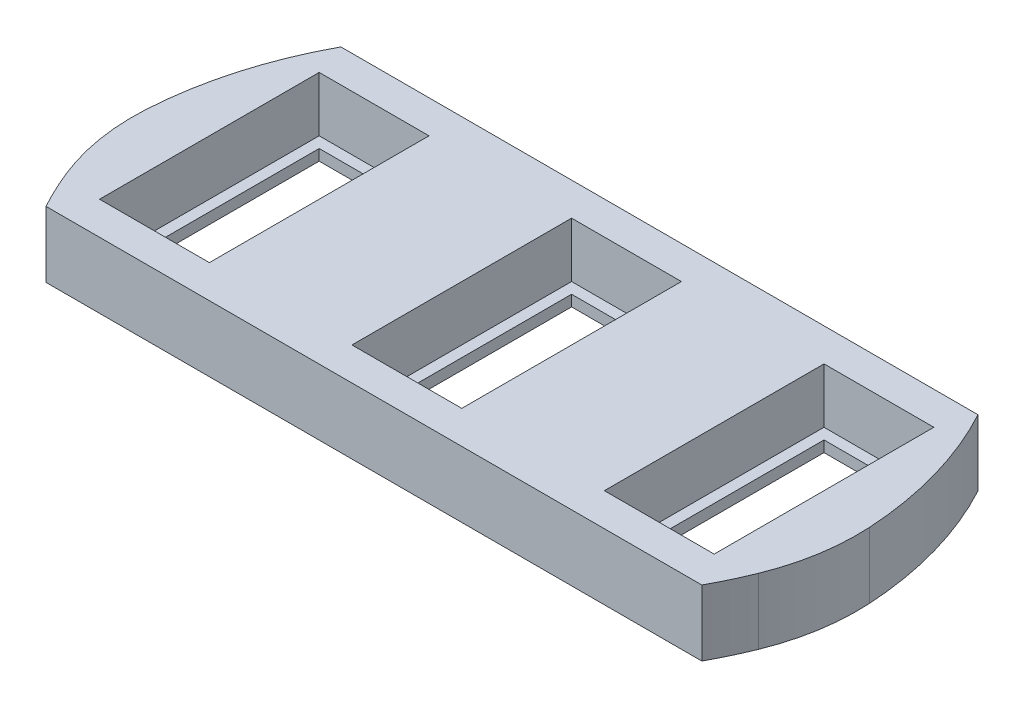
from build123d import *

# Parameters (mm, degrees)
ESQUISSE1_W        = 8
ESQUISSE1_H        = 18
BOSS_EXTRU_1_DEPTH = 1
ESQUISSE2_W        = 10
ESQUISSE2_H        = 20
BOSS_EXTRU_2_DEPTH = 5


with BuildPart() as part:
    # Esquisse1 → Boss.-Extru.1 (new body)
    with BuildSketch(Plane(origin=(0, 0, 0), x_dir=(1, 0, 0), z_dir=(0, 1, 0))):
        with BuildLine():
            Line((29.004988077, 12.738826724), (-29.004988077, 12.738826724))
            ThreePointArc((-29.004988077, 12.738826724), (-31.738037586, 6.038637628), (-32.945035587, -1.096153846))
            ThreePointArc((-32.945035587, -1.096153846), (-32.712152787, -5.502218178), (-31.51884357, -9.75))
            ThreePointArc((-31.51884357, -9.75), (-30.739215763, -11.52930192), (-29.859240507, -13.261173276))
            Line((-29.859240507, -13.261173276), (29.859240507, -13.261173276))
            ThreePointArc((29.859240507, -13.261173276), (30.739215763, -11.52930192), (31.51884357, -9.75))
            ThreePointArc((31.51884357, -9.75), (32.712152787, -5.502218178), (32.945035587, -1.096153846))
            ThreePointArc((32.945035587, -1.096153846), (31.738037586, 6.038637628), (29.004988077, 12.738826724))
        make_face()
        with Locations((22.983419658, -0.261173276)):
            Rectangle(ESQUISSE1_W, ESQUISSE1_H, mode=Mode.SUBTRACT)
        with Locations((-22.983419658, -0.261173276)):
            Rectangle(ESQUISSE1_W, ESQUISSE1_H, mode=Mode.SUBTRACT)
        with Locations((0, -0.261173276)):
            Rectangle(ESQUISSE1_W, ESQUISSE1_H, mode=Mode.SUBTRACT)
    extrude(amount=BOSS_EXTRU_1_DEPTH)

    # Esquisse2 → Boss.-Extru.2 (add)
    with BuildSketch(Plane(origin=(0, 1, 0), x_dir=(1, 0, 0), z_dir=(0, 1, 0))):
        with BuildLine():
            Line((-29.004988077, 12.738826724), (29.004988077, 12.738826724))
            ThreePointArc((29.004988077, 12.738826724), (31.738037586, 6.038637628), (32.945035587, -1.096153846))
            ThreePointArc((32.945035587, -1.096153846), (32.712152787, -5.502218178), (31.51884357, -9.75))
            ThreePointArc((31.51884357, -9.75), (30.739215763, -11.52930192), (29.859240507, -13.261173276))
            Line((29.859240507, -13.261173276), (0, -13.261173276))
            Line((0, -13.261173276), (-29.859240507, -13.261173276))
            ThreePointArc((-29.859240507, -13.261173276), (-30.739215763, -11.52930192), (-31.51884357, -9.75))
            ThreePointArc((-31.51884357, -9.75), (-32.712152787, -5.502218178), (-32.945035587, -1.096153846))
            ThreePointArc((-32.945035587, -1.096153846), (-31.738037586, 6.038637628), (-29.004988077, 12.738826724))
        make_face()
        with Locations((-22.983419658, -0.261173276)):
            Rectangle(ESQUISSE2_W, ESQUISSE2_H, mode=Mode.SUBTRACT)
        with Locations((22.983419658, -0.261173276)):
            Rectangle(ESQUISSE2_W, ESQUISSE2_H, mode=Mode.SUBTRACT)
        with Locations((0, -0.261173276)):
            Rectangle(ESQUISSE2_W, ESQUISSE2_H, mode=Mode.SUBTRACT)
    extrude(amount=BOSS_EXTRU_2_DEPTH)


solid = part.part
